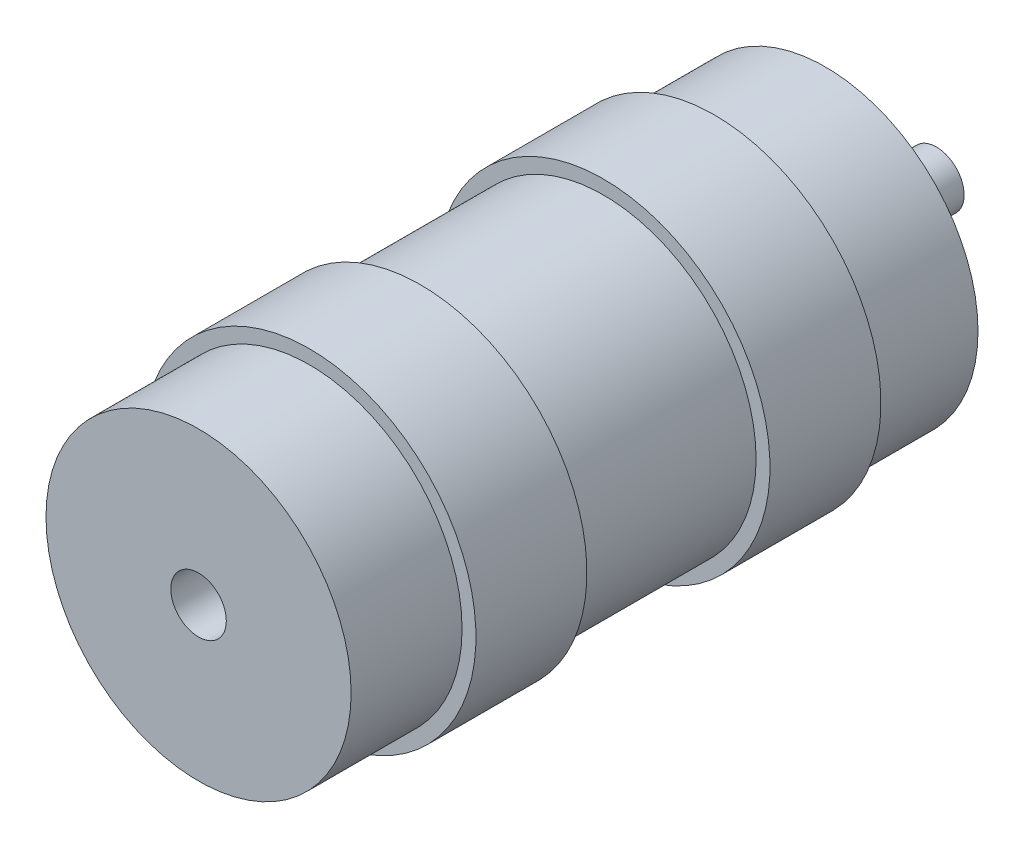
from build123d import *

# Parameters (mm, degrees)
SKETCH1_R                = 5
BOSS_EXTRUDE1_DEPTH      = 20
SKETCH2_R                = 27.5
BOSS_EXTRUDE2_DEPTH      = 113
BOSS_EXTRUDE3_DEPTH      = 10
BOSS_EXTRUDE3_DEPTH_BACK = 10
SKETCH3_R                = 30
BOSS_EXTRUDE4_DEPTH      = 10
BOSS_EXTRUDE4_DEPTH_BACK = 10
SKETCH4_R                = 30
CUT_EXTRUDE1_START       = -20
SKETCH5_R                = 5
CUT_EXTRUDE1_DEPTH       = 20


with BuildPart() as part:
    # Sketch1 → Boss-Extrude1 (new body)
    with BuildSketch(Plane.XY):
        Circle(SKETCH1_R)
    extrude(amount=BOSS_EXTRUDE1_DEPTH)

    # Sketch2 → Boss-Extrude2 (add)
    with BuildSketch(Plane.XY.offset(20)):
        Circle(SKETCH2_R)
    extrude(amount=BOSS_EXTRUDE2_DEPTH)

    # Sketch3 → Boss-Extrude3 (add, two sides: drawn at the far end of the back side and taken through both)
    with BuildSketch(Plane(origin=(0, 0, 50), x_dir=(-1, 0, 0), z_dir=(0, 0, -1)).offset(-BOSS_EXTRUDE3_DEPTH_BACK)):
        Circle(SKETCH3_R)
    extrude(amount=BOSS_EXTRUDE3_DEPTH + BOSS_EXTRUDE3_DEPTH_BACK)

    # Sketch4 → Boss-Extrude4 (add, two sides: drawn at the far end of the back side and taken through both)
    with BuildSketch(Plane(origin=(0, 0, 103), x_dir=(-1, 0, 0), z_dir=(0, 0, -1)).offset(-BOSS_EXTRUDE4_DEPTH_BACK)):
        Circle(SKETCH4_R)
    extrude(amount=BOSS_EXTRUDE4_DEPTH + BOSS_EXTRUDE4_DEPTH_BACK)

    # Sketch5 → Cut-Extrude1 (cut)
    with BuildSketch(Plane.XY.offset(133).offset(CUT_EXTRUDE1_START)):
        Circle(SKETCH5_R)
    extrude(amount=CUT_EXTRUDE1_DEPTH, mode=Mode.SUBTRACT)


solid = part.part
